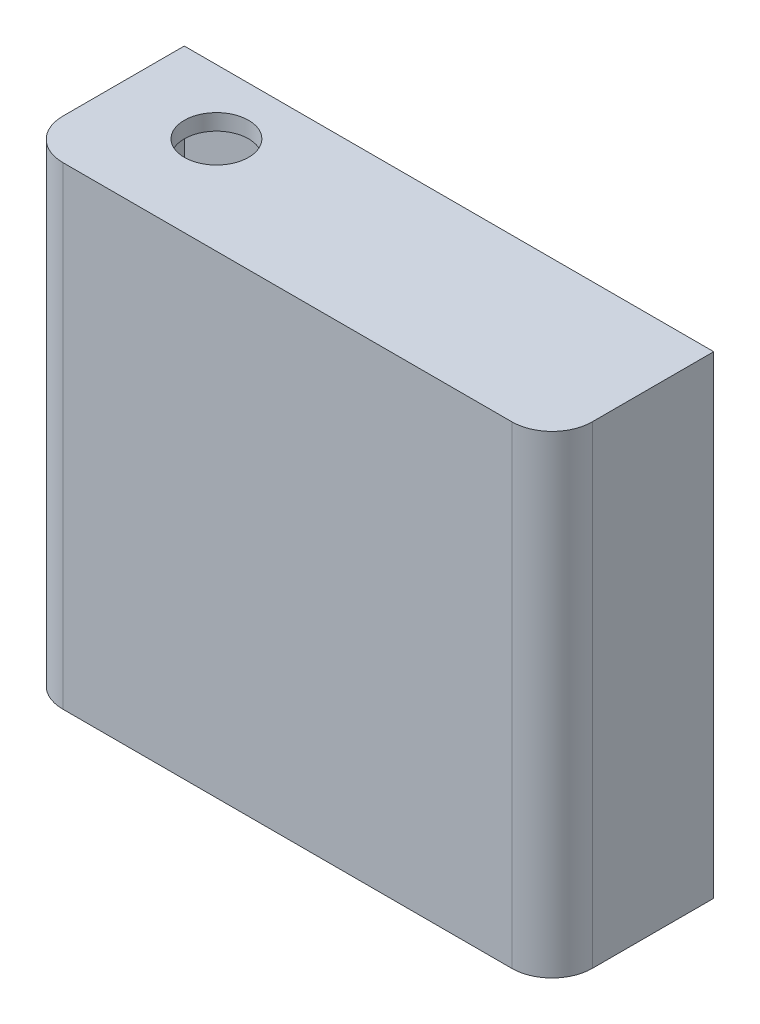
from build123d import *

# Parameters (mm, degrees)
SKETCH_1_W               = 65.868
SKETCH_1_H               = 56.896
EXTRUDE_1_DEPTH          = 2
CUT_EXTRUDE_1_DEPTH      = 86.409420089
CUT_EXTRUDE_1_DEPTH_BACK = 86.409420089
SKETCH_3_W               = 2
SKETCH_3_H               = 56.896
EXTRUDE_2_DEPTH          = 18.113
SKETCH_4_W               = 65.868
SKETCH_4_H               = 56.896
EXTRUDE_3_DEPTH          = 2
SKETCH_5_W               = 65.868
SKETCH_5_H               = 20.113
EXTRUDE_4_DEPTH          = 2
FILLET_1_R               = 5
CUT_EXTRUDE_2_DEPTH      = 89.403664002
CUT_EXTRUDE_2_DEPTH_BACK = 89.403664002
SKETCH_6_R               = 4


with BuildPart() as part:
    # Эскиз1 → Бобышка-Вытянуть1 (new body)
    with BuildSketch(Plane(origin=(0, 0, -15.113), x_dir=(-1, 0, 0), z_dir=(0, 0, -1))):
        with Locations((-30.734, 28.448)):
            Rectangle(SKETCH_1_W, SKETCH_1_H)
    extrude(amount=EXTRUDE_1_DEPTH)

    # Эскиз2 → Вырез-Вытянуть1 (cut, two sides: drawn at the far end of the back side and taken through both)
    with BuildSketch(Plane(origin=(0, 0, -17.113), x_dir=(-1, 0, 0), z_dir=(0, 0, -1)).offset(-CUT_EXTRUDE_1_DEPTH_BACK)):
        Polygon((-20.084, 40.396), (-1.8, 40.396), (-1.8, 28.396), (-20.084, 28.396), (-24.084, 28.396), (-24.084, 40.396), align=None)
    extrude(amount=CUT_EXTRUDE_1_DEPTH + CUT_EXTRUDE_1_DEPTH_BACK, mode=Mode.SUBTRACT)

    # Эскиз3 → Бобышка-Вытянуть2 (add)
    with BuildSketch(Plane.XY.offset(-15.113)):
        with Locations((-1.2, 28.448)):
            Rectangle(SKETCH_3_W, SKETCH_3_H)
        with Locations((62.668, 28.448)):
            Rectangle(SKETCH_3_W, SKETCH_3_H)
    extrude(amount=EXTRUDE_2_DEPTH)

    # Эскиз4 → Бобышка-Вытянуть3 (add)
    with BuildSketch(Plane.XY.offset(3)):
        with Locations((30.734, 28.448)):
            Rectangle(SKETCH_4_W, SKETCH_4_H)
    extrude(amount=-EXTRUDE_3_DEPTH)

    # Эскиз5 → Бобышка-Вытянуть4 (add)
    with BuildSketch(Plane(origin=(0, 56.896, 0), x_dir=(1, 0, 0), z_dir=(0, 1, 0))):
        with Locations((30.734, 7.0565)):
            Rectangle(SKETCH_5_W, SKETCH_5_H)
    extrude(amount=EXTRUDE_4_DEPTH)

    # Скругление1
    fillet_1_edges = [part.edges().sort_by_distance(p)[0] for p in [
        (-2.2, 29.448, 3),
        (63.668, 29.448, 3),
        (61.668, 28.448, 1),
        (-0.2, 28.448, 1),
    ]]
    fillet(fillet_1_edges, radius=FILLET_1_R)

    # Эскиз6 → Вырез-Вытянуть2 (cut, two sides: drawn at the far end of the back side and taken through both)
    with BuildSketch(Plane(origin=(0, 58.896, 0), x_dir=(1, 0, 0), z_dir=(0, 1, 0)).offset(-CUT_EXTRUDE_2_DEPTH_BACK)):
        with Locations(Location((9.8, 9.113, 0), (0, 0, 180))):
            Circle(SKETCH_6_R)
    extrude(amount=CUT_EXTRUDE_2_DEPTH + CUT_EXTRUDE_2_DEPTH_BACK, mode=Mode.SUBTRACT)


solid = part.part
